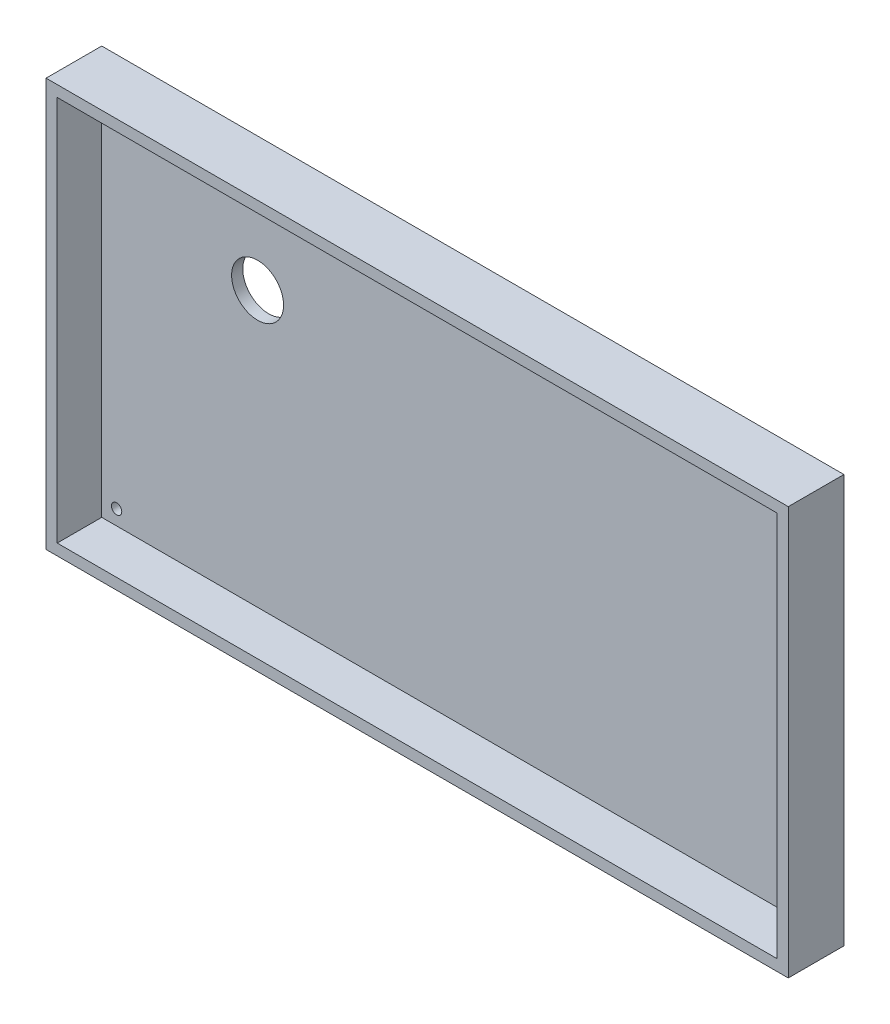
from build123d import *

# Parameters (mm, degrees)
SKETCH1_W           = 200
SKETCH1_H           = 110
BOSS_EXTRUDE1_DEPTH = 3
SKETCH2_W           = 200
SKETCH2_H           = 110
SKETCH2_W_2         = 194
SKETCH2_H_2         = 104
BOSS_EXTRUDE2_DEPTH = 12
SKETCH3_R           = 1.4
CUT_EXTRUDE2_DEPTH  = 3
SKETCH5_R           = 7
CUT_EXTRUDE3_DEPTH  = 3


with BuildPart() as part:
    # Sketch1 → Boss-Extrude1 (new body)
    with BuildSketch(Plane.XY):
        with Locations((3.991596639, -23.697478992)):
            Rectangle(SKETCH1_W, SKETCH1_H)
    extrude(amount=BOSS_EXTRUDE1_DEPTH)

    # Sketch2 → Boss-Extrude2 (add)
    with BuildSketch(Plane.XY.offset(3)):
        with Locations((3.991596639, -23.697478992)):
            Rectangle(SKETCH2_W, SKETCH2_H)
        with Locations((3.991596639, -23.697478992)):
            Rectangle(SKETCH2_W_2, SKETCH2_H_2, mode=Mode.SUBTRACT)
    extrude(amount=BOSS_EXTRUDE2_DEPTH)

    # Sketch3 → Cut-Extrude2 (cut)
    with BuildSketch(Plane.XY.offset(3)):
        with Locations((-89.008403361, 24.302521008)):
            Circle(SKETCH3_R)
        with Locations((-89.008403361, -71.697478992)):
            Circle(SKETCH3_R)
        with Locations((96.991596639, 24.302521008)):
            Circle(SKETCH3_R)
        with Locations((96.991596639, -71.697478992)):
            Circle(SKETCH3_R)
    extrude(amount=-CUT_EXTRUDE2_DEPTH, mode=Mode.SUBTRACT)

    # Sketch5 → Cut-Extrude3 (cut)
    with BuildSketch(Plane.XY.offset(3)):
        with Locations((-51.008403361, -1.697478992)):
            Circle(SKETCH5_R)
    extrude(amount=-CUT_EXTRUDE3_DEPTH, mode=Mode.SUBTRACT)


solid = part.part
